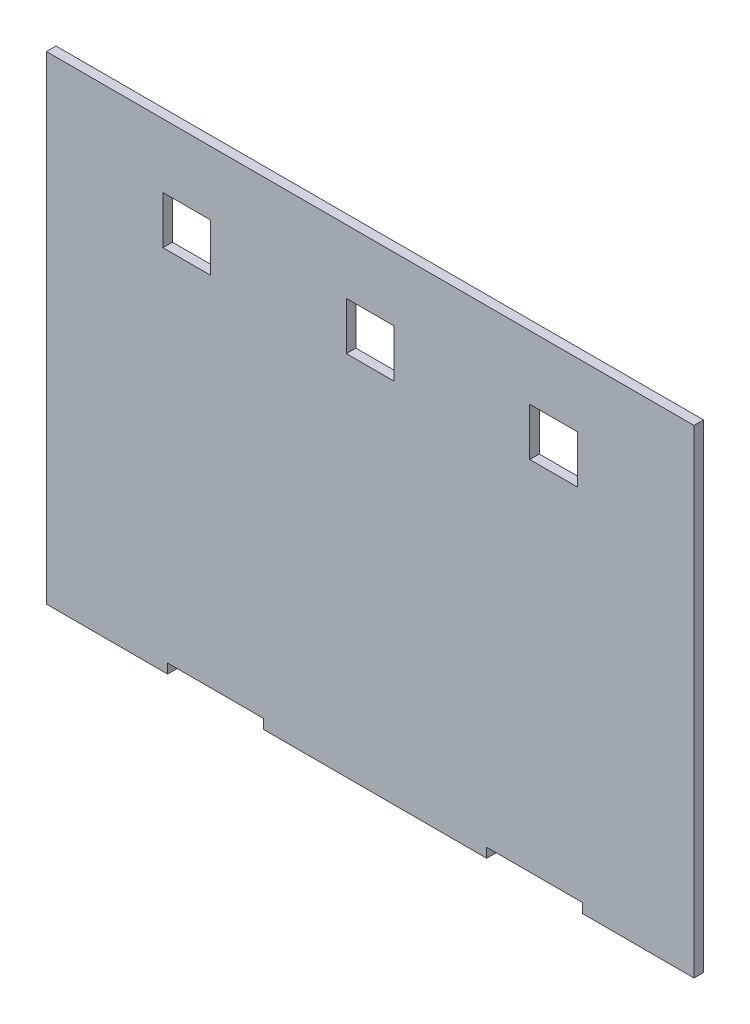
from build123d import *

# Parameters (mm, degrees)
SKETCH1_W           = 203
SKETCH1_H           = 150
BOSS_EXTRUDE1_DEPTH = 3
SKETCH2_W           = 15
SKETCH2_H           = 15
CUT_EXTRUDE1_DEPTH  = 127.238860895
SKETCH3_W           = 30
SKETCH3_H           = 3
CUT_EXTRUDE2_DEPTH  = 10


with BuildPart() as part:
    # Sketch1 → Boss-Extrude1 (new body)
    with BuildSketch(Plane.XY):
        Rectangle(SKETCH1_W, SKETCH1_H)
    extrude(amount=BOSS_EXTRUDE1_DEPTH)

    # Sketch2 → Cut-Extrude1 (cut, through all)
    with BuildSketch(Plane.XY.offset(3)):
        with Locations((-57.5, 47.5)):
            Rectangle(SKETCH2_W, SKETCH2_H)
        with Locations((57.5, 47.5)):
            Rectangle(SKETCH2_W, SKETCH2_H)
        with Locations((0, 47.5)):
            Rectangle(SKETCH2_W, SKETCH2_H)
    extrude(amount=-CUT_EXTRUDE1_DEPTH, mode=Mode.SUBTRACT)

    # Sketch3 → Cut-Extrude2 (cut)
    with BuildSketch(Plane.XY.offset(3)):
        with Locations((-48.5, -73.5)):
            Rectangle(SKETCH3_W, SKETCH3_H)
        with Locations((51.5, -73.5)):
            Rectangle(SKETCH3_W, SKETCH3_H)
    extrude(amount=-CUT_EXTRUDE2_DEPTH, mode=Mode.SUBTRACT)


solid = part.part
